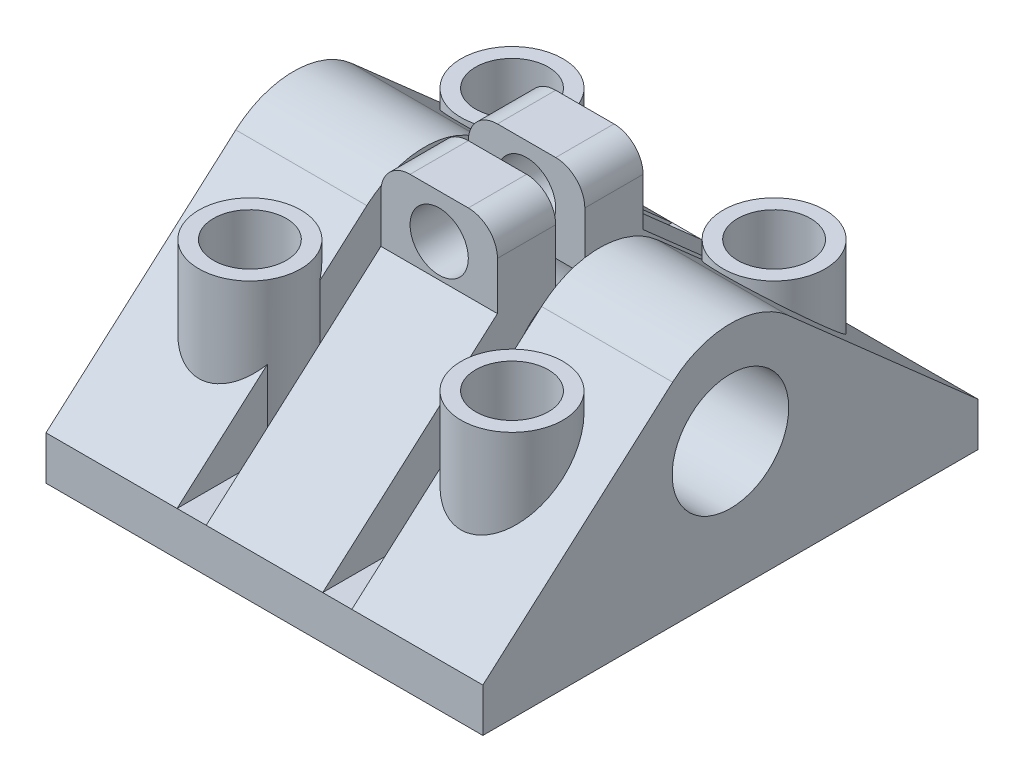
from build123d import *

# Parameters (mm, degrees)
SKETCH1_W           = 30
SKETCH1_H           = 34
SKETCH1_R           = 2.5
BOSS_EXTRUDE1_DEPTH = 3
SKETCH2_R           = 4
BOSS_EXTRUDE2_DEPTH = 30
SKETCH3_R           = 2.5
CUT_EXTRUDE1_DEPTH  = 49.082685508
SKETCH4_W           = 2
SKETCH4_H           = 13.407026696
CUT_EXTRUDE2_DEPTH  = 49.082685508
CUT_EXTRUDE3_REACH  = 44.106
SKETCH5_W           = 2
SKETCH5_H           = 4.553085987
SKETCH6_W           = 4
SKETCH6_H           = 6
SKETCH6_H_2         = 5.998001256
BOSS_EXTRUDE3_DEPTH = 8
SKETCH7_R           = 2
CUT_EXTRUDE4_DEPTH  = 42.715578629
FILLET1_R           = 2
SKETCH8_R           = 3.5
SKETCH8_R_2         = 2.5
BOSS_EXTRUDE4_DEPTH = 13.5


with BuildPart() as part:
    # Sketch1 → Boss-Extrude1 (new body)
    with BuildSketch(Plane(origin=(0, 0, 0), x_dir=(1, 0, 0), z_dir=(0, 1, 0))):
        with Locations((15, 17)):
            Rectangle(SKETCH1_W, SKETCH1_H)
        with Locations(Location((6, 26, 0), (0, 0, 270))):
            Circle(SKETCH1_R, mode=Mode.SUBTRACT)
        with Locations(Location((24, 26, 0), (0, 0, 270))):
            Circle(SKETCH1_R, mode=Mode.SUBTRACT)
        with Locations(Location((6, 8, 0), (0, 0, 270))):
            Circle(SKETCH1_R, mode=Mode.SUBTRACT)
        with Locations(Location((24, 8, 0), (0, 0, 270))):
            Circle(SKETCH1_R, mode=Mode.SUBTRACT)
    extrude(amount=BOSS_EXTRUDE1_DEPTH)

    # Sketch2 → Boss-Extrude2 (add, through all)
    with BuildSketch(Plane(origin=(30, 0, 0), x_dir=(0, 0, -1), z_dir=(1, 0, 0))):
        with BuildLine():
            Line((34, 3), (20.969729823, 14.497297215))
            ThreePointArc((20.969729823, 14.497297215), (17, 15.998270083), (13.030270177, 14.497297215))
            Line((13.030270177, 14.497297215), (0, 3))
            Line((0, 3), (34, 3))
        make_face()
        with Locations((17, 9)):
            Circle(SKETCH2_R, mode=Mode.SUBTRACT)
    extrude(amount=-BOSS_EXTRUDE2_DEPTH)

    # Sketch3 → Cut-Extrude1 (cut, through all)
    with BuildSketch(Plane.XZ):
        with Locations(Location((6, -8, 0), (0, 0, 90))):
            Circle(SKETCH3_R)
        with Locations(Location((24, -8, 0), (0, 0, 90))):
            Circle(SKETCH3_R)
        with Locations(Location((24, -26, 0), (0, 0, 270))):
            Circle(SKETCH3_R)
        with Locations(Location((6, -26, 0), (0, 0, 270))):
            Circle(SKETCH3_R)
    extrude(amount=-CUT_EXTRUDE1_DEPTH, mode=Mode.SUBTRACT)

    # Sketch4 → Cut-Extrude2 (cut, through all)
    with BuildSketch(Plane.XY):
        with Locations((10, 9.703513348)):
            Rectangle(SKETCH4_W, SKETCH4_H)
        with Locations((20, 9.703513348)):
            Rectangle(SKETCH4_W, SKETCH4_H)
    extrude(amount=-CUT_EXTRUDE2_DEPTH, mode=Mode.SUBTRACT)

    # Sketch5 → Cut-Extrude3 (cut, up to next)
    with BuildSketch(Plane.ZY.offset(-11), mode=Mode.PRIVATE) as cut_extrude3_sk1:
        with Locations((-17, 14.233519348)):
            Rectangle(SKETCH5_W, SKETCH5_H)
    cut_extrude3_tool1 = extrude(cut_extrude3_sk1.sketch, amount=-CUT_EXTRUDE3_REACH, mode=Mode.PRIVATE) & part.part
    add(cut_extrude3_tool1.solids().sort_by_distance((11, 14.233519, -17))[0], mode=Mode.SUBTRACT)

    # Sketch6 → Boss-Extrude3 (add)
    with BuildSketch(Plane.ZY.offset(-11)):
        with Locations((-14, 15.872983346)):
            Rectangle(SKETCH6_W, SKETCH6_H)
        with Locations((-20, 15.871983974)):
            Rectangle(SKETCH6_W, SKETCH6_H_2)
    extrude(amount=-BOSS_EXTRUDE3_DEPTH)

    # Sketch7 → Cut-Extrude4 (cut, through all)
    with BuildSketch(Plane.XY.offset(-12)):
        with Locations(Location((15, 15.872983346, 0), (0, 0, 90))):
            Circle(SKETCH7_R)
    extrude(amount=-CUT_EXTRUDE4_DEPTH, mode=Mode.SUBTRACT)

    # Fillet1
    fillet1_edges = [part.edges().sort_by_distance(p)[0] for p in [
        (19, 18.872983346, -14),
        (11, 18.872983346, -14),
        (19, 18.870984602, -20),
        (11, 18.870984602, -20),
    ]]
    fillet(fillet1_edges, radius=FILLET1_R)

    # Sketch8 → Boss-Extrude4 (add)
    # profile 1 of 4: a face of its own
    with BuildSketch(Plane(origin=(0, 0, 0), x_dir=(-1, 0, 0), z_dir=(0, -1, 0))):
        with Locations(Location((-6, 8, 0), (0, 0, 90))):
            Circle(SKETCH8_R)
        with Locations(Location((-6, 8, 0), (0, 0, 90))):
            Circle(SKETCH8_R_2, mode=Mode.SUBTRACT)
    # profile 2 of 4: a face of its own
    with BuildSketch(Plane(origin=(0, 0, 0), x_dir=(-1, 0, 0), z_dir=(0, -1, 0))):
        with Locations(Location((-24, 8, 0), (0, 0, 90))):
            Circle(SKETCH8_R)
        with Locations(Location((-24, 8, 0), (0, 0, 90))):
            Circle(SKETCH8_R_2, mode=Mode.SUBTRACT)
    # profile 3 of 4: a face of its own
    with BuildSketch(Plane(origin=(0, 0, 0), x_dir=(-1, 0, 0), z_dir=(0, -1, 0))):
        with Locations(Location((-6, 26, 0), (0, 0, 90))):
            Circle(SKETCH8_R)
        with Locations(Location((-6, 26, 0), (0, 0, 90))):
            Circle(SKETCH8_R_2, mode=Mode.SUBTRACT)
    # profile 4 of 4: a face of its own
    with BuildSketch(Plane(origin=(0, 0, 0), x_dir=(-1, 0, 0), z_dir=(0, -1, 0))):
        with Locations(Location((-24, 26, 0), (0, 0, 90))):
            Circle(SKETCH8_R)
        with Locations(Location((-24, 26, 0), (0, 0, 90))):
            Circle(SKETCH8_R_2, mode=Mode.SUBTRACT)
    extrude(amount=-BOSS_EXTRUDE4_DEPTH)


solid = part.part
